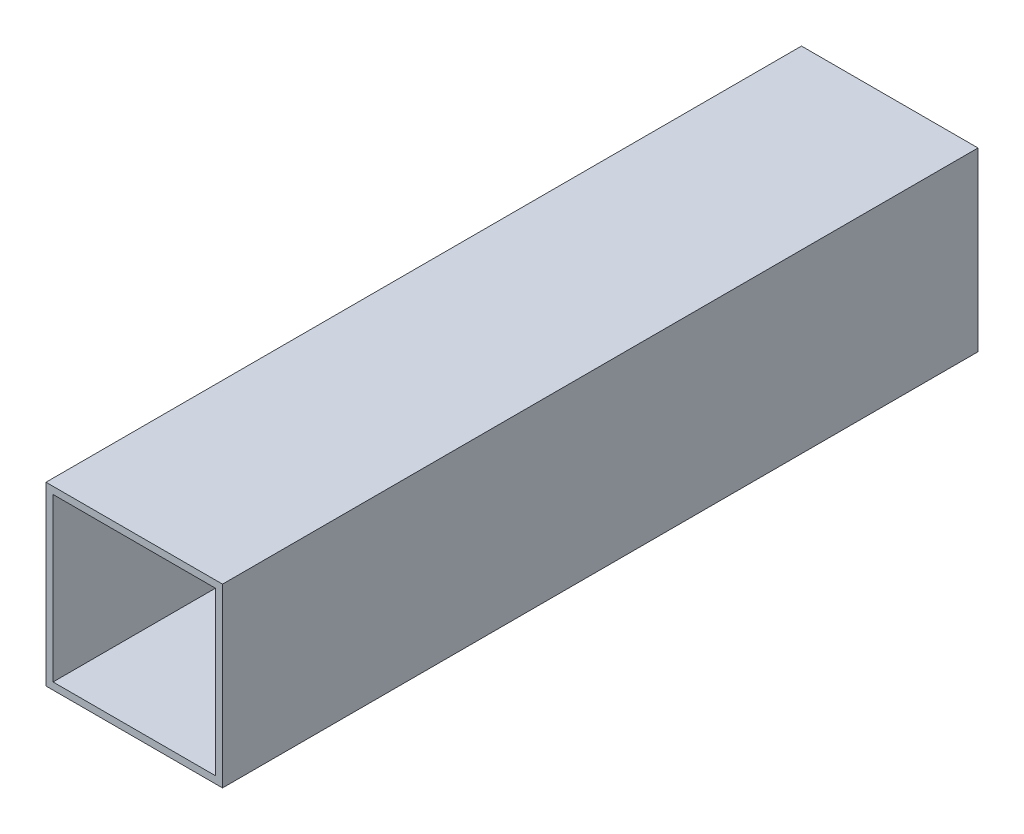
from build123d import *

# Parameters (mm, degrees)
SKETCH1_W           = 50
SKETCH1_H           = 50
SKETCH1_W_2         = 46
SKETCH1_H_2         = 46
BOSS_EXTRUDE1_DEPTH = 214


with BuildPart() as part:
    # Sketch1 → Boss-Extrude1 (new body)
    with BuildSketch(Plane.XY):
        Rectangle(SKETCH1_W, SKETCH1_H)
        Rectangle(SKETCH1_W_2, SKETCH1_H_2, mode=Mode.SUBTRACT)
    extrude(amount=BOSS_EXTRUDE1_DEPTH)


solid = part.part
